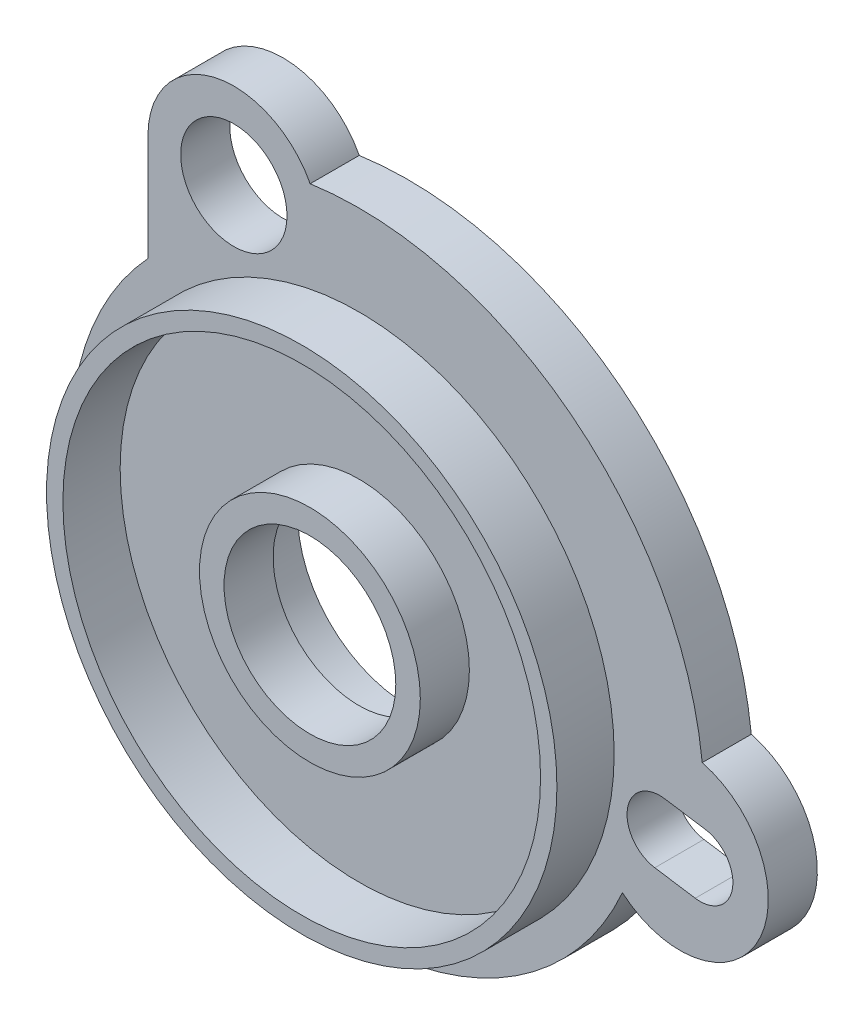
from build123d import *

# Parameters (mm, degrees)
SKETCH_1_R      = 14.6
EXTRUDE_1_DEPTH = 3.5
SKETCH_1_4_R    = 6.75
SKETCH_1_4_R_2  = 5.25
EXTRUDE_2_DEPTH = 3
SKETCH_1_5_R    = 3.25
SKETCH_1_5_R_2  = 6.75
EXTRUDE_3_DEPTH = 3


with BuildPart() as part:
    # Эскиз1 → Бобышка-Вытянуть1 (new body)
    with BuildSketch(Plane.XY):
        with BuildLine():
            ThreePointArc((15.6, 0), (4.589117562, 14.909728368), (-12.9, 8.77211491))
            ThreePointArc((-12.9, 8.77211491), (-7.054522331, -13.91379584), (14.700159992, -5.221618161))
            ThreePointArc((14.700159992, -5.221618161), (15.373394158, -2.649292748), (15.6, 0))
        make_face()
        Circle(SKETCH_1_R, mode=Mode.SUBTRACT)
    extrude(amount=EXTRUDE_1_DEPTH)


with BuildPart() as body_2:
    # Эскиз1<4> → Бобышка-Вытянуть2 (new body)
    with BuildSketch(Plane.XY):
        Circle(SKETCH_1_4_R)
        Circle(SKETCH_1_4_R_2, mode=Mode.SUBTRACT)
    extrude(amount=EXTRUDE_2_DEPTH)


with BuildPart() as body_3:
    # Эскиз1<5> → Бобышка-Вытянуть3 (new body)
    with BuildSketch(Plane.XY):
        with BuildLine():
            ThreePointArc((-12.9, 11.972886035), (-9.669131149, -14.706049872), (16.105276229, -7.097892475))
            ThreePointArc((16.105276229, -7.097892475), (24.406931227, -5.50286626), (20.982267102, 2.225863258))
            ThreePointArc((20.982267102, 2.225863258), (12.963054137, 16.648400146), (-2.985146295, 20.887769187))
            ThreePointArc((-2.985146295, 20.887769187), (-8.889358312, 23.580726333), (-12.9, 18.479109827))
            Line((-12.9, 18.479109827), (-12.9, 11.972886035))
        make_face()
        with Locations((-7.65, 18.479109827)):
            Circle(SKETCH_1_5_R, mode=Mode.SUBTRACT)
        with BuildLine():
            Line((18.688615516, -0.834056402), (21.159898919, -1.211890155))
            ThreePointArc((21.159898919, -1.211890155), (22.834658638, -3.491183879), (20.555364914, -5.165943598))
            Line((20.555364914, -5.165943598), (18.084081511, -4.788109845))
            ThreePointArc((18.084081511, -4.788109845), (16.409321792, -2.508816121), (18.688615516, -0.834056402))
        make_face(mode=Mode.SUBTRACT)
        Circle(SKETCH_1_5_R_2, mode=Mode.SUBTRACT)
    extrude(amount=-EXTRUDE_3_DEPTH)


solid = Compound([part.part, body_2.part, body_3.part])
